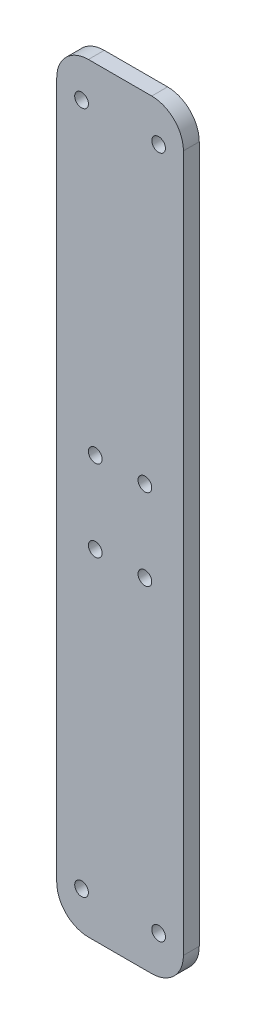
from build123d import *
from build123d.topology import SkipClean

# Parameters (mm, degrees)
SKETCH1_W               = 15.24
SKETCH1_H               = 279.4
BOSS_EXTRUDE3_DEPTH     = 6.35
SKETCH2_R               = 2.75
CUT_EXTRUDE1_DEPTH      = 174.437553604
SKETCH3_W               = 15.24
SKETCH3_H               = 279.4
BOSS_EXTRUDE4_DEPTH     = 6.35
CUT_EXTRUDE2_DEPTH      = 174.437553604
CUT_EXTRUDE2_DEPTH_BACK = 174.437553604
SKETCH4_R               = 2.75


with BuildPart() as part:
    # Sketch1 → Boss-Extrude3 (new body)
    with BuildSketch(Plane.XY.offset(8)):
        with BuildLine():
            Line((-69.85, -152.4), (-44.45, -152.4))
            ThreePointArc((-44.45, -152.4), (-35.469743879, -148.680256121), (-31.75, -139.7))
            Line((-31.75, -139.7), (-31.75, 139.7))
            ThreePointArc((-31.75, 139.7), (-35.469743879, 148.680256121), (-44.45, 152.4))
            Line((-44.45, 152.4), (-69.85, 152.4))
            ThreePointArc((-69.85, 152.4), (-78.830256121, 148.680256121), (-82.55, 139.7))
            Line((-82.55, 139.7), (-82.55, -139.7))
            ThreePointArc((-82.55, -139.7), (-78.830256121, -148.680256121), (-69.85, -152.4))
        make_face()
        with Locations((-57.15, 0)):
            Rectangle(SKETCH1_W, SKETCH1_H, mode=Mode.SUBTRACT)
        with BuildLine():
            ThreePointArc((-44.45, -136.95), (-39.755456352, -135.005456352), (-41.7, -139.7))
            ThreePointArc((-41.7, -139.7), (-42.505456352, -137.755456352), (-44.45, -136.95))
        make_face(mode=Mode.SUBTRACT)
        with BuildLine():
            ThreePointArc((-72.6, -139.7), (-74.544543648, -135.005456352), (-69.85, -136.95))
            ThreePointArc((-69.85, -136.95), (-71.794543648, -137.755456352), (-72.6, -139.7))
        make_face(mode=Mode.SUBTRACT)
        with BuildLine():
            ThreePointArc((-41.7, 139.7), (-39.755456352, 135.005456352), (-44.45, 136.95))
            ThreePointArc((-44.45, 136.95), (-42.505456352, 137.755456352), (-41.7, 139.7))
        make_face(mode=Mode.SUBTRACT)
        with BuildLine():
            ThreePointArc((-69.85, 136.95), (-74.544543648, 135.005456352), (-72.6, 139.7))
            ThreePointArc((-72.6, 139.7), (-71.794543648, 137.755456352), (-69.85, 136.95))
        make_face(mode=Mode.SUBTRACT)
    extrude(amount=-BOSS_EXTRUDE3_DEPTH)

    # Sketch2 → Cut-Extrude1 (cut, through all)
    with SkipClean():  # the faces are left unmerged after this step: merging them gives an invalid solid
        with BuildSketch(Plane.XY.offset(8)):
            with Locations(Location((-41.7, 136.95, 0), (0, 0, 180))):
                Circle(SKETCH2_R)
            with Locations(Location((-72.6, 136.95, 0), (0, 0, 180))):
                Circle(SKETCH2_R)
            with Locations(Location((-41.7, -136.95, 0), (0, 0, 180))):
                Circle(SKETCH2_R)
            with Locations(Location((-72.6, -136.95, 0), (0, 0, 180))):
                Circle(SKETCH2_R)
        extrude(amount=-CUT_EXTRUDE1_DEPTH, mode=Mode.SUBTRACT)

    # Sketch3 → Boss-Extrude4 (add)
    with SkipClean():  # the faces are left unmerged after this step: merging them gives an invalid solid
        with BuildSketch(Plane.XY.offset(8)):
            with Locations((-57.15, 0)):
                Rectangle(SKETCH3_W, SKETCH3_H)
        extrude(amount=-BOSS_EXTRUDE4_DEPTH)

    # Sketch4 → Cut-Extrude2 (cut, two sides: drawn at the far end of the back side and taken through both)
    with SkipClean():  # the faces are left unmerged after this step: merging them gives an invalid solid
        with BuildSketch(Plane(origin=(0, 0, 1.65), x_dir=(-1, 0, 0), z_dir=(0, 0, -1)).offset(-CUT_EXTRUDE2_DEPTH_BACK)):
            with Locations((47.2, 16.3)):
                Circle(SKETCH4_R)
            with Locations((67.1, 16.3)):
                Circle(SKETCH4_R)
            with Locations((47.2, -16.3)):
                Circle(SKETCH4_R)
            with Locations((67.1, -16.3)):
                Circle(SKETCH4_R)
        extrude(amount=CUT_EXTRUDE2_DEPTH + CUT_EXTRUDE2_DEPTH_BACK, mode=Mode.SUBTRACT)


solid = part.part
